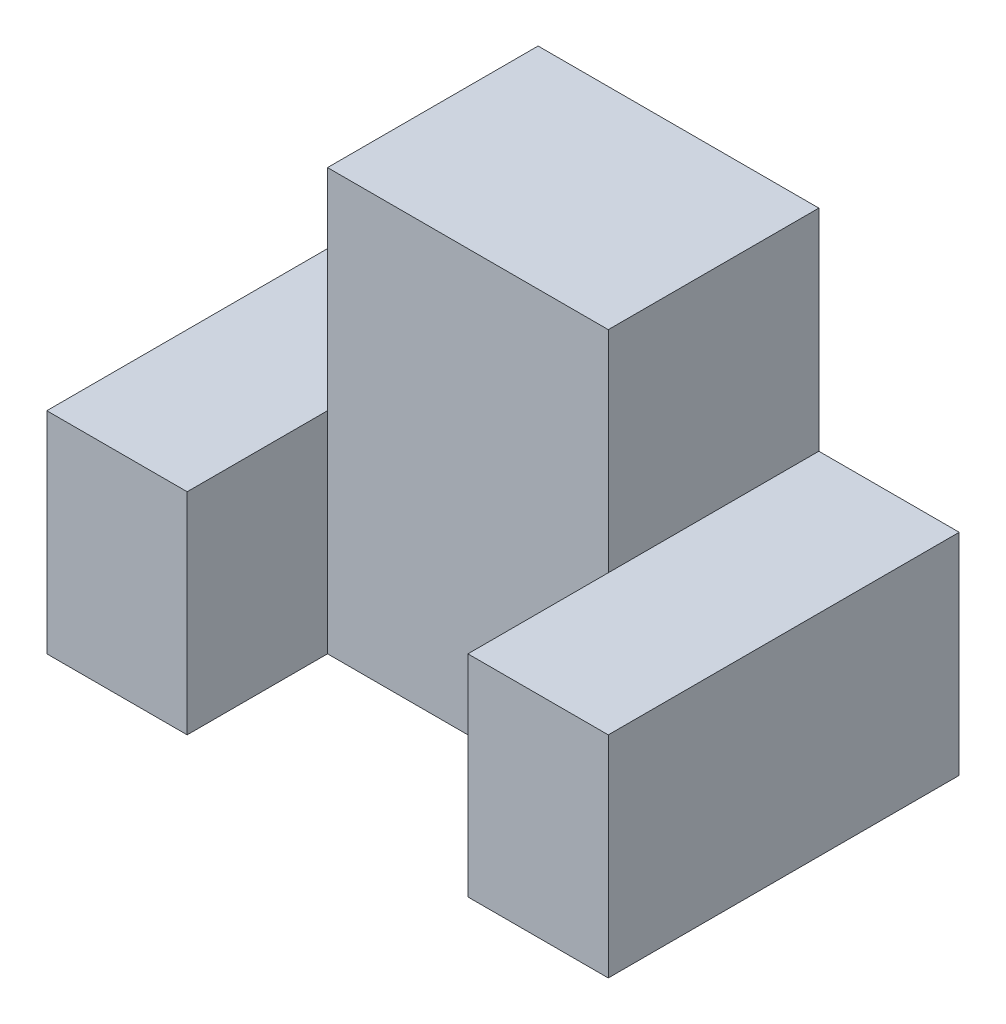
from build123d import *

# Parameters (mm, degrees)
CROQUIS2_W              = 40
CROQUIS2_H              = 60
SALIENTE_EXTRUIR1_DEPTH = 30
CROQUIS3_W              = 50
CROQUIS3_H              = 30
SALIENTE_EXTRUIR2_DEPTH = 20
CROQUIS4_W              = 50
CROQUIS4_H              = 30
SALIENTE_EXTRUIR3_DEPTH = 20


with BuildPart() as part:
    # Croquis2 → Saliente-Extruir1 (new body)
    with BuildSketch(Plane.XY):
        Rectangle(CROQUIS2_W, CROQUIS2_H)
    extrude(amount=SALIENTE_EXTRUIR1_DEPTH)

    # Croquis3 → Saliente-Extruir2 (add)
    with BuildSketch(Plane(origin=(20, 0, 0), x_dir=(0, 0, -1), z_dir=(1, 0, 0))):
        with Locations((-25, -15)):
            Rectangle(CROQUIS3_W, CROQUIS3_H)
    extrude(amount=SALIENTE_EXTRUIR2_DEPTH)

    # Croquis4 → Saliente-Extruir3 (add)
    with BuildSketch(Plane.ZY.offset(20)):
        with Locations((25, -15)):
            Rectangle(CROQUIS4_W, CROQUIS4_H)
    extrude(amount=SALIENTE_EXTRUIR3_DEPTH)


solid = part.part
